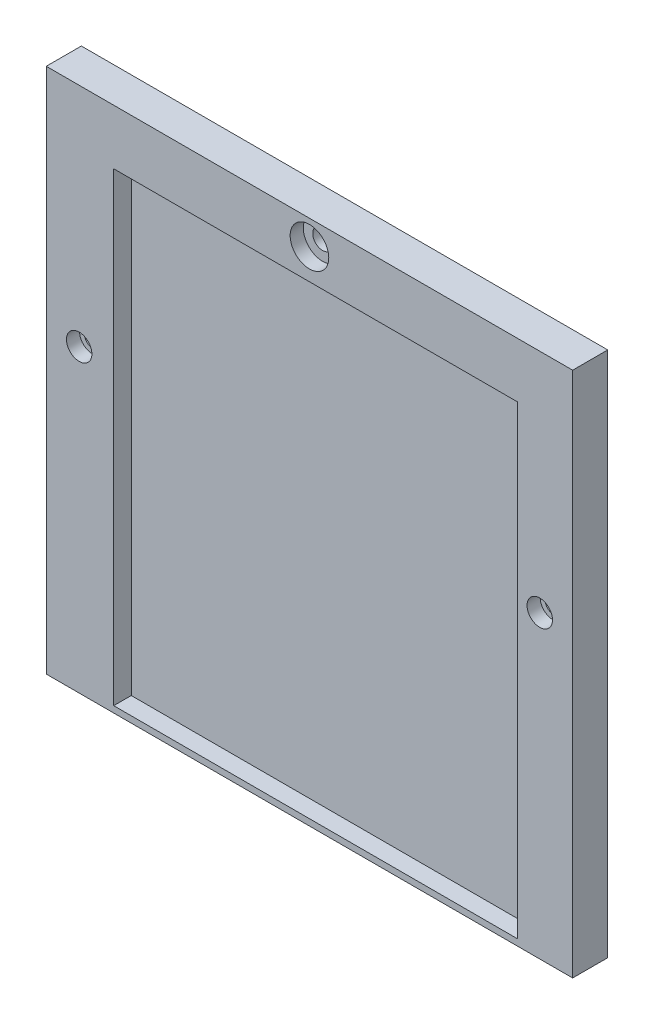
from build123d import *

# Parameters (mm, degrees)
SKETCH_1_W          = 120
SKETCH_1_H          = 120
EXTRUDE_1_DEPTH     = 8
SKETCH_3_R          = 2.25
CUT_EXTRUDE_1_DEPTH = 8
SKETCH_4_R          = 4.4
CUT_EXTRUDE_2_DEPTH = 3
SKETCH_5_R          = 1.75
CUT_EXTRUDE_3_DEPTH = 8
SKETCH_6_R          = 2.9
CUT_EXTRUDE_4_DEPTH = 3
SKETCH_7_R          = 1.75
CUT_EXTRUDE_5_DEPTH = 8
SKETCH_8_R          = 2.9
CUT_EXTRUDE_6_DEPTH = 3
SKETCH_9_W          = 92
SKETCH_9_H          = 106
CUT_EXTRUDE_7_DEPTH = 4


with BuildPart() as part:
    # 草图1 → 凸台-拉伸1 (new body)
    with BuildSketch(Plane.XY):
        with Locations((4.838054616, 23.07265118)):
            Rectangle(SKETCH_1_W, SKETCH_1_H)
    extrude(amount=EXTRUDE_1_DEPTH)

    # 草图3 → 切除-拉伸1 (cut)
    with BuildSketch(Plane.XY.offset(8)):
        with Locations((4.838054616, 77.454324244)):
            Circle(SKETCH_3_R)
    extrude(amount=-CUT_EXTRUDE_1_DEPTH, mode=Mode.SUBTRACT)

    # 草图4 → 切除-拉伸2 (cut)
    with BuildSketch(Plane.XY.offset(8)):
        with Locations((4.838054616, 77.454324244)):
            Circle(SKETCH_4_R)
    extrude(amount=-CUT_EXTRUDE_2_DEPTH, mode=Mode.SUBTRACT)

    # 草图5 → 切除-拉伸3 (cut)
    with BuildSketch(Plane.XY.offset(8)):
        with Locations((57.34, 31.45)):
            Circle(SKETCH_5_R)
    extrude(amount=-CUT_EXTRUDE_3_DEPTH, mode=Mode.SUBTRACT)

    # 草图6 → 切除-拉伸4 (cut)
    with BuildSketch(Plane.XY.offset(8)):
        with Locations((57.34, 31.45)):
            Circle(SKETCH_6_R)
    extrude(amount=-CUT_EXTRUDE_4_DEPTH, mode=Mode.SUBTRACT)

    # 草图7 → 切除-拉伸5 (cut)
    with BuildSketch(Plane.XY.offset(8)):
        with Locations((-47.66, 31.45)):
            Circle(SKETCH_7_R)
    extrude(amount=-CUT_EXTRUDE_5_DEPTH, mode=Mode.SUBTRACT)

    # 草图8 → 切除-拉伸6 (cut)
    with BuildSketch(Plane.XY.offset(8)):
        with Locations((-47.66, 31.45)):
            Circle(SKETCH_8_R)
    extrude(amount=-CUT_EXTRUDE_6_DEPTH, mode=Mode.SUBTRACT)

    # 草图9 → 切除-拉伸7 (cut)
    with BuildSketch(Plane.XY.offset(8)):
        with Locations((6.215593236, 17.526521265)):
            Rectangle(SKETCH_9_W, SKETCH_9_H)
    extrude(amount=-CUT_EXTRUDE_7_DEPTH, mode=Mode.SUBTRACT)


solid = part.part
